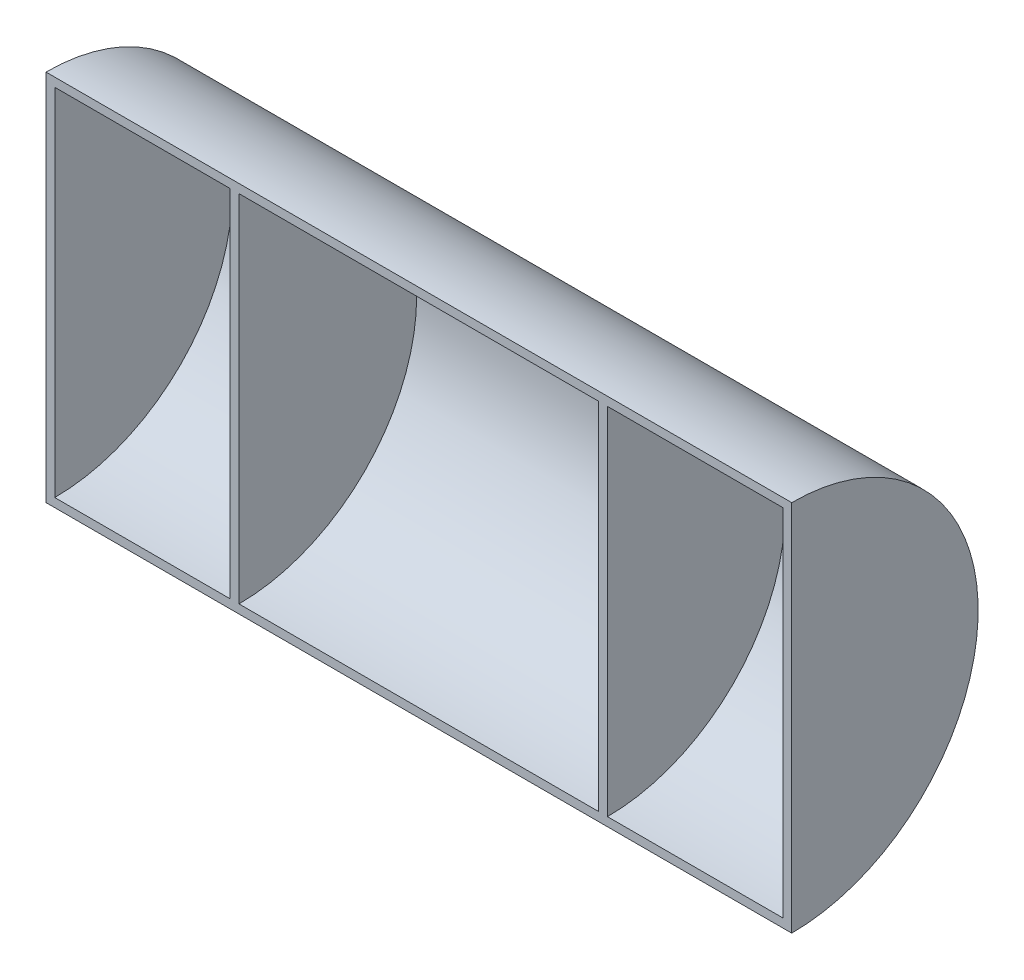
from build123d import *

# Parameters (mm, degrees)
PROFILE_EXTRUDE_DEPTH = 170
PROFILE_SHELL_T       = -2
SUPPORT_EXTRUDE_REACH = 182.312
SUPPORT_SKETCH_W      = 2
SUPPORT_SKETCH_H      = 81


with BuildPart() as part:
    # Profile Sketch → Profile Extrude (new body)
    with BuildSketch(Plane(origin=(0, 0, 0), x_dir=(0, 0, -1), z_dir=(1, 0, 0))):
        with BuildLine():
            Line((0, 42.5), (0, -42.5))
            ThreePointArc((0, -42.5), (42.5, 0), (0, 42.5))
        make_face()
    extrude(amount=-PROFILE_EXTRUDE_DEPTH)

    # Profile Shell
    profile_shell_openings = [part.faces().sort_by_distance(p)[0] for p in [
        (-85, 0, 0),
    ]]
    offset(amount=PROFILE_SHELL_T, openings=profile_shell_openings)

    # Support Sketch → Support Extrude (add, up to next)
    with BuildSketch(Plane.XY, mode=Mode.PRIVATE) as support_extrude_sk1:
        with Locations((-127, 0)):
            Rectangle(SUPPORT_SKETCH_W, SUPPORT_SKETCH_H)
    support_extrude_tool1 = extrude(support_extrude_sk1.sketch, amount=-SUPPORT_EXTRUDE_REACH, mode=Mode.PRIVATE) - part.part
    # Support Sketch → Support Extrude (add, up to next)
    with BuildSketch(Plane.XY, mode=Mode.PRIVATE) as support_extrude_sk2:
        with Locations((-43, 0)):
            Rectangle(SUPPORT_SKETCH_W, SUPPORT_SKETCH_H)
    support_extrude_tool2 = extrude(support_extrude_sk2.sketch, amount=-SUPPORT_EXTRUDE_REACH, mode=Mode.PRIVATE) - part.part
    add(support_extrude_tool1.solids().sort_by_distance((-127, 0, 0))[0])
    add(support_extrude_tool2.solids().sort_by_distance((-43, 0, 0))[0])


solid = part.part
